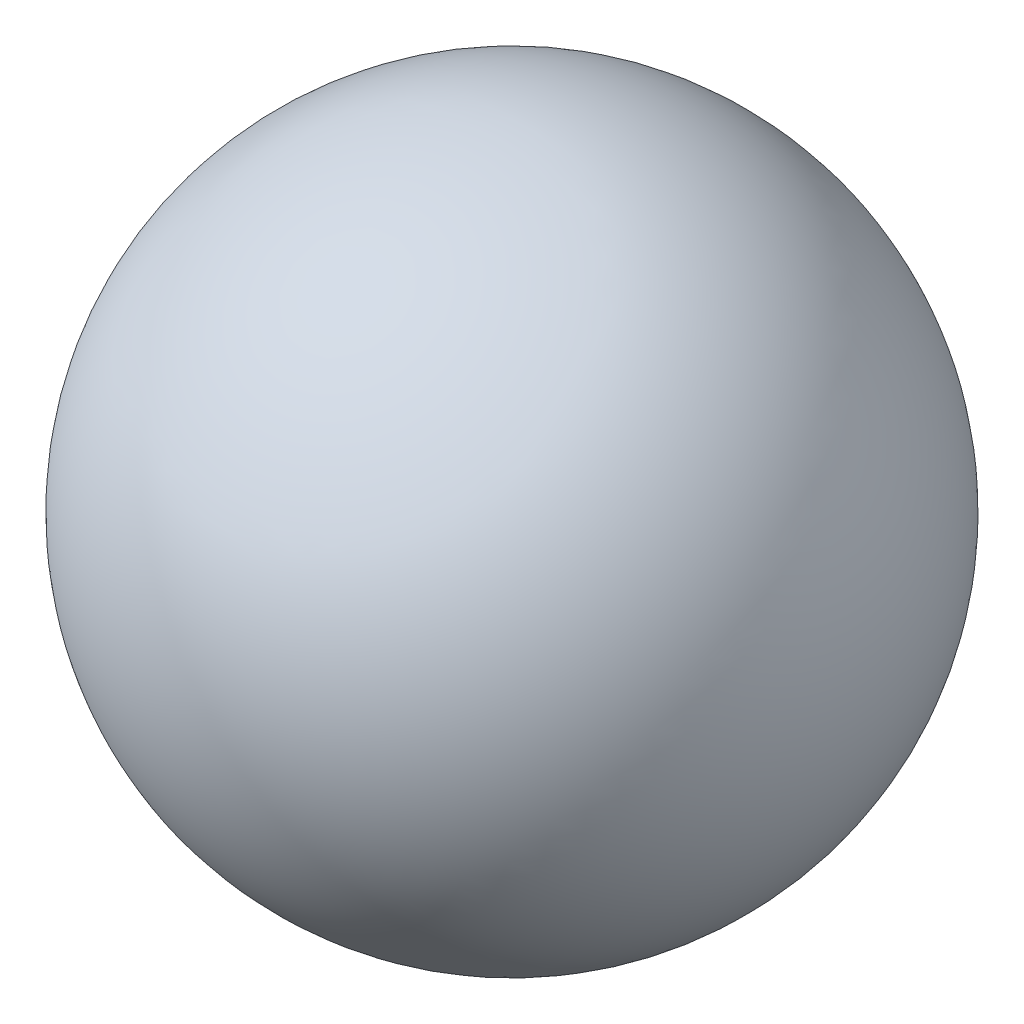
from build123d import *


with BuildPart() as part:
    # Sketch1 → Revolve1 (revolve)
    with BuildSketch(Plane(origin=(0, 0, 0), x_dir=(1, 0, 0), z_dir=(0, 1, 0))):
        with BuildLine():
            Line((0, 15.24), (0, -15.24))
            ThreePointArc((0, -15.24), (15.24, 0), (0, 15.24))
        make_face()
    revolve(axis=Axis((0, 0, -15.24), (0, 0, 1)))


solid = part.part
